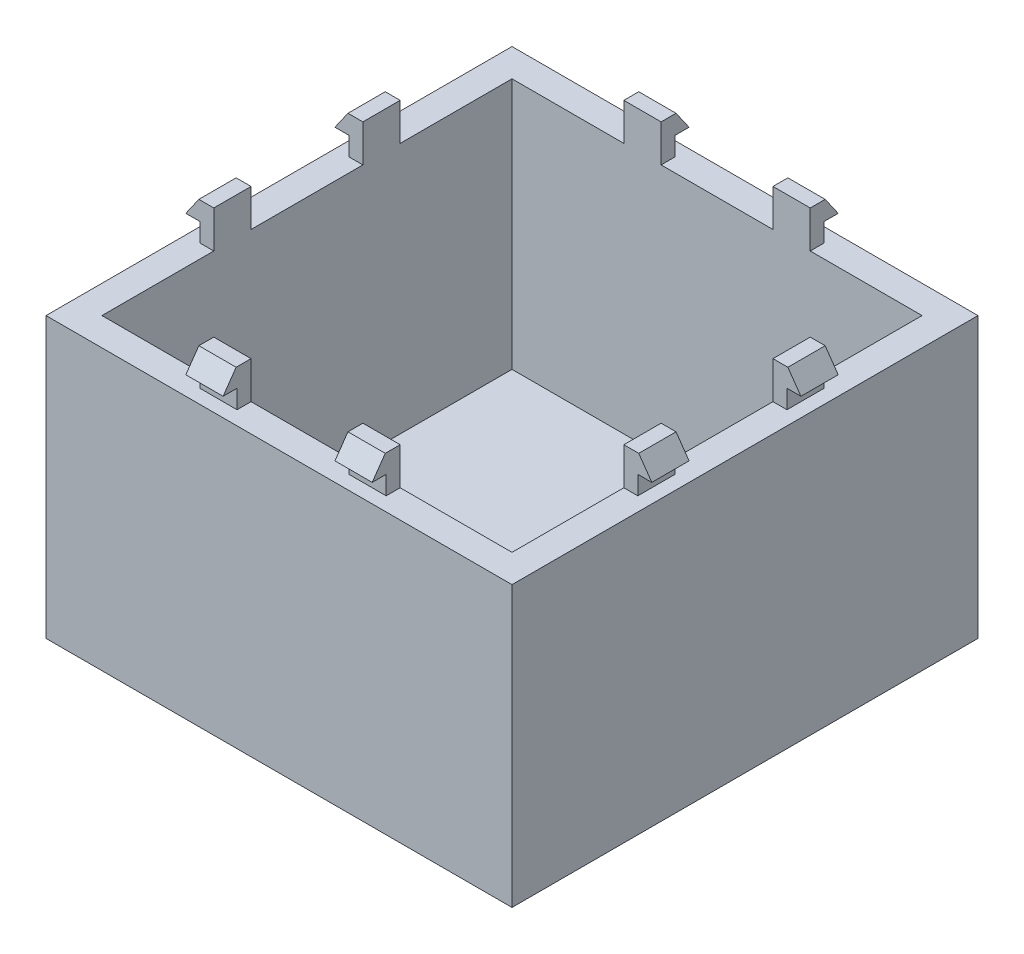
from build123d import *

# Parameters (mm, degrees)
SKETCH_1_W      = 50
SKETCH_1_H      = 50
EXTRUDE_1_DEPTH = 3
SKETCH_2_W      = 50
SKETCH_2_H      = 50
SKETCH_2_W_2    = 44
SKETCH_2_H_2    = 44
EXTRUDE_2_DEPTH = 27
SKETCH_3_W      = 4
SKETCH_3_H      = 1.5
SKETCH_3_W_2    = 1.5
SKETCH_3_H_2    = 4
EXTRUDE_3_DEPTH = 4


with BuildPart() as part:
    # 草图1 → 凸台-拉伸1 (new body)
    with BuildSketch(Plane(origin=(0, 0, 0), x_dir=(1, 0, 0), z_dir=(0, 1, 0))):
        Rectangle(SKETCH_1_W, SKETCH_1_H)
    extrude(amount=EXTRUDE_1_DEPTH)

    # 草图2 → 凸台-拉伸2 (add)
    with BuildSketch(Plane(origin=(0, 3, 0), x_dir=(1, 0, 0), z_dir=(0, 1, 0))):
        Rectangle(SKETCH_2_W, SKETCH_2_H)
        Rectangle(SKETCH_2_W_2, SKETCH_2_H_2, mode=Mode.SUBTRACT)
    extrude(amount=EXTRUDE_2_DEPTH)

    # 草图3 → 凸台-拉伸3 (add)
    with BuildSketch(Plane(origin=(0, 30, 0), x_dir=(1, 0, 0), z_dir=(0, 1, 0))):
        with Locations((-8, -22.75)):
            Rectangle(SKETCH_3_W, SKETCH_3_H)
        with Locations((8, -22.75)):
            Rectangle(SKETCH_3_W, SKETCH_3_H)
        with Locations((-22.75, 8)):
            Rectangle(SKETCH_3_W_2, SKETCH_3_H_2)
        with Locations((-22.75, -8)):
            Rectangle(SKETCH_3_W_2, SKETCH_3_H_2)
        with Locations((8, 22.75)):
            Rectangle(SKETCH_3_W, SKETCH_3_H)
        with Locations((-8, 22.75)):
            Rectangle(SKETCH_3_W, SKETCH_3_H)
        with Locations((22.75, -8)):
            Rectangle(SKETCH_3_W_2, SKETCH_3_H_2)
        with Locations((22.75, 8)):
            Rectangle(SKETCH_3_W_2, SKETCH_3_H_2)
    extrude(amount=EXTRUDE_3_DEPTH)

    # 草图4 → 放样2 section 0
    with BuildSketch(Plane(origin=(0, 34, 0), x_dir=(1, 0, 0), z_dir=(0, 1, 0))):
        with BuildLine():
            Line((-23.5, 10), (-23.6, 10))
            Line((-23.6, 10), (-23.6, 6))
            Line((-23.6, 6), (-23.5, 6))
            Line((-23.5, 6), (-23.5, 10))
        make_face()
    # 草图6 → 放样2 section 1
    with BuildSketch(Plane(origin=(0, 32, 0), x_dir=(1, 0, 0), z_dir=(0, 1, 0))):
        with BuildLine():
            Line((-23.5, 10), (-25, 10))
            Line((-25, 10), (-25, 6))
            Line((-25, 6), (-23.5, 6))
            Line((-23.5, 6), (-23.5, 10))
        make_face()
    loft()

    # 草图8 → 放样3 section 0
    with BuildSketch(Plane(origin=(0, 34, 0), x_dir=(1, 0, 0), z_dir=(0, 1, 0))):
        with BuildLine():
            Line((-23.5, -6), (-23.6, -6))
            Line((-23.6, -6), (-23.6, -10))
            Line((-23.6, -10), (-23.5, -10))
            Line((-23.5, -10), (-23.5, -6))
        make_face()
    # 草图9 → 放样3 section 1
    with BuildSketch(Plane(origin=(0, 32, 0), x_dir=(1, 0, 0), z_dir=(0, 1, 0))):
        with BuildLine():
            Line((-23.5, -6), (-25, -6))
            Line((-25, -6), (-25, -10))
            Line((-25, -10), (-23.5, -10))
            Line((-23.5, -10), (-23.5, -6))
        make_face()
    loft()

    # 草图10 → 放样4 section 0
    with BuildSketch(Plane(origin=(0, 34, 0), x_dir=(1, 0, 0), z_dir=(0, 1, 0))):
        with BuildLine():
            Line((-10, -23.5), (-6, -23.5))
            Line((-6, -23.5), (-6, -23.6))
            Line((-6, -23.6), (-10, -23.6))
            Line((-10, -23.6), (-10, -23.5))
        make_face()
    # 草图11 → 放样4 section 1
    with BuildSketch(Plane(origin=(0, 32, 0), x_dir=(1, 0, 0), z_dir=(0, 1, 0))):
        with BuildLine():
            Line((-10, -23.5), (-6, -23.5))
            Line((-6, -23.5), (-6, -25))
            Line((-6, -25), (-10, -25))
            Line((-10, -25), (-10, -23.5))
        make_face()
    loft()

    # 草图12 → 放样5 section 0
    with BuildSketch(Plane(origin=(0, 34, 0), x_dir=(1, 0, 0), z_dir=(0, 1, 0))):
        with BuildLine():
            Line((6, -23.5), (10, -23.5))
            Line((10, -23.5), (10, -23.6))
            Line((10, -23.6), (6, -23.6))
            Line((6, -23.6), (6, -23.5))
        make_face()
    # 草图13 → 放样5 section 1
    with BuildSketch(Plane(origin=(0, 32, 0), x_dir=(1, 0, 0), z_dir=(0, 1, 0))):
        with BuildLine():
            Line((6, -23.5), (10, -23.5))
            Line((10, -23.5), (10, -25))
            Line((10, -25), (6, -25))
            Line((6, -25), (6, -23.5))
        make_face()
    loft()

    # 草图14 → 放样6 section 0
    with BuildSketch(Plane(origin=(0, 34, 0), x_dir=(1, 0, 0), z_dir=(0, 1, 0))):
        with BuildLine():
            Line((23.5, -10), (23.6, -10))
            Line((23.6, -10), (23.6, -6))
            Line((23.6, -6), (23.5, -6))
            Line((23.5, -6), (23.5, -10))
        make_face()
    # 草图15 → 放样6 section 1
    with BuildSketch(Plane(origin=(0, 32, 0), x_dir=(1, 0, 0), z_dir=(0, 1, 0))):
        with BuildLine():
            Line((23.5, -10), (25, -10))
            Line((25, -10), (25, -6))
            Line((25, -6), (23.5, -6))
            Line((23.5, -6), (23.5, -10))
        make_face()
    loft()

    # 草图16 → 放样7 section 0
    with BuildSketch(Plane(origin=(0, 34, 0), x_dir=(1, 0, 0), z_dir=(0, 1, 0))):
        with BuildLine():
            Line((23.5, 6), (23.6, 6))
            Line((23.6, 6), (23.6, 10))
            Line((23.6, 10), (23.5, 10))
            Line((23.5, 10), (23.5, 6))
        make_face()
    # 草图17 → 放样7 section 1
    with BuildSketch(Plane(origin=(0, 32, 0), x_dir=(1, 0, 0), z_dir=(0, 1, 0))):
        with BuildLine():
            Line((23.5, 6), (25, 6))
            Line((25, 6), (25, 10))
            Line((25, 10), (23.5, 10))
            Line((23.5, 10), (23.5, 6))
        make_face()
    loft()

    # 草图18 → 放样8 section 0
    with BuildSketch(Plane(origin=(0, 34, 0), x_dir=(1, 0, 0), z_dir=(0, 1, 0))):
        with BuildLine():
            Line((-6, 23.5), (-10, 23.5))
            Line((-10, 23.5), (-10, 23.6))
            Line((-10, 23.6), (-6, 23.6))
            Line((-6, 23.6), (-6, 23.5))
        make_face()
    # 草图19 → 放样8 section 1
    with BuildSketch(Plane(origin=(0, 32, 0), x_dir=(1, 0, 0), z_dir=(0, 1, 0))):
        with BuildLine():
            Line((-6, 23.5), (-10, 23.5))
            Line((-10, 23.5), (-10, 25))
            Line((-10, 25), (-6, 25))
            Line((-6, 25), (-6, 23.5))
        make_face()
    loft()

    # 草图20 → 放样9 section 0
    with BuildSketch(Plane(origin=(0, 34, 0), x_dir=(1, 0, 0), z_dir=(0, 1, 0))):
        with BuildLine():
            Line((10, 23.5), (6, 23.5))
            Line((6, 23.5), (6, 23.6))
            Line((6, 23.6), (10, 23.6))
            Line((10, 23.6), (10, 23.5))
        make_face()
    # 草图21 → 放样9 section 1
    with BuildSketch(Plane(origin=(0, 32, 0), x_dir=(1, 0, 0), z_dir=(0, 1, 0))):
        with BuildLine():
            Line((10, 23.5), (6, 23.5))
            Line((6, 23.5), (6, 25))
            Line((6, 25), (10, 25))
            Line((10, 25), (10, 23.5))
        make_face()
    loft()


solid = part.part
